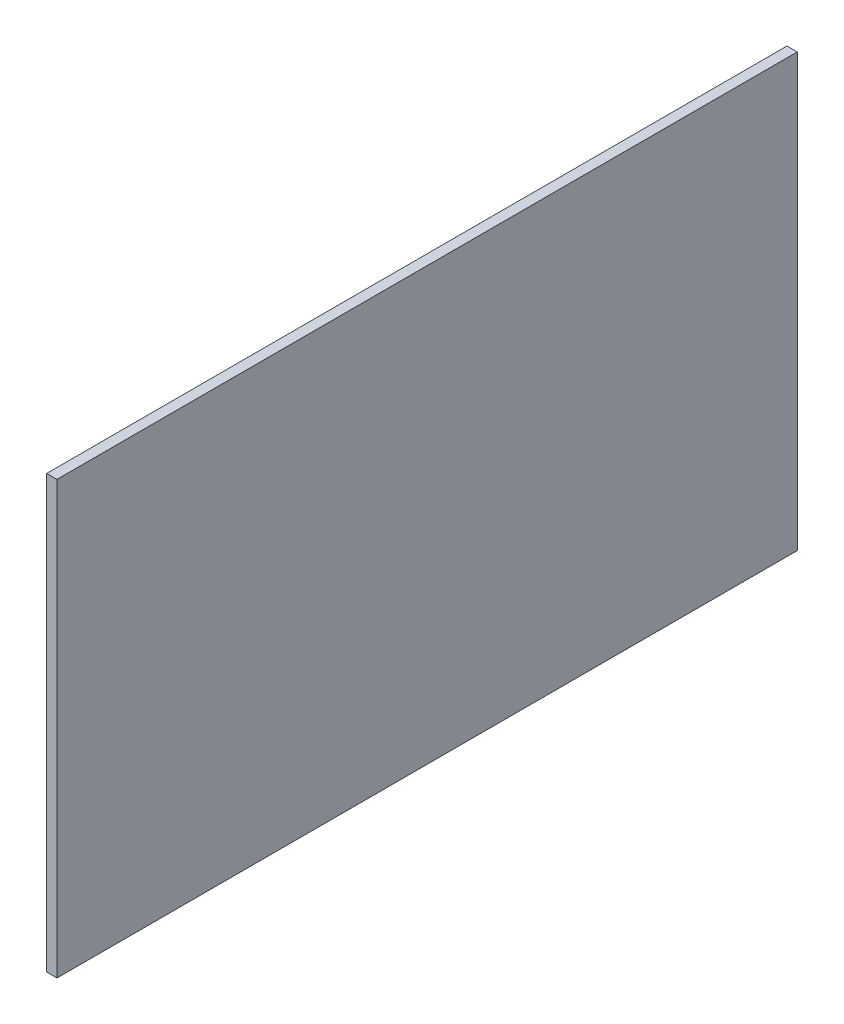
from build123d import *

# Parameters (mm, degrees)
SKETCH1_W           = 114.3
SKETCH1_H           = 66.675
BOSS_EXTRUDE1_DEPTH = 1.5875


with BuildPart() as part:
    # Sketch1 → Boss-Extrude1 (new body)
    with BuildSketch(Plane(origin=(0, 0, 0), x_dir=(0, 0, -1), z_dir=(1, 0, 0))):
        Rectangle(SKETCH1_W, SKETCH1_H)
    extrude(amount=BOSS_EXTRUDE1_DEPTH)


solid = part.part
